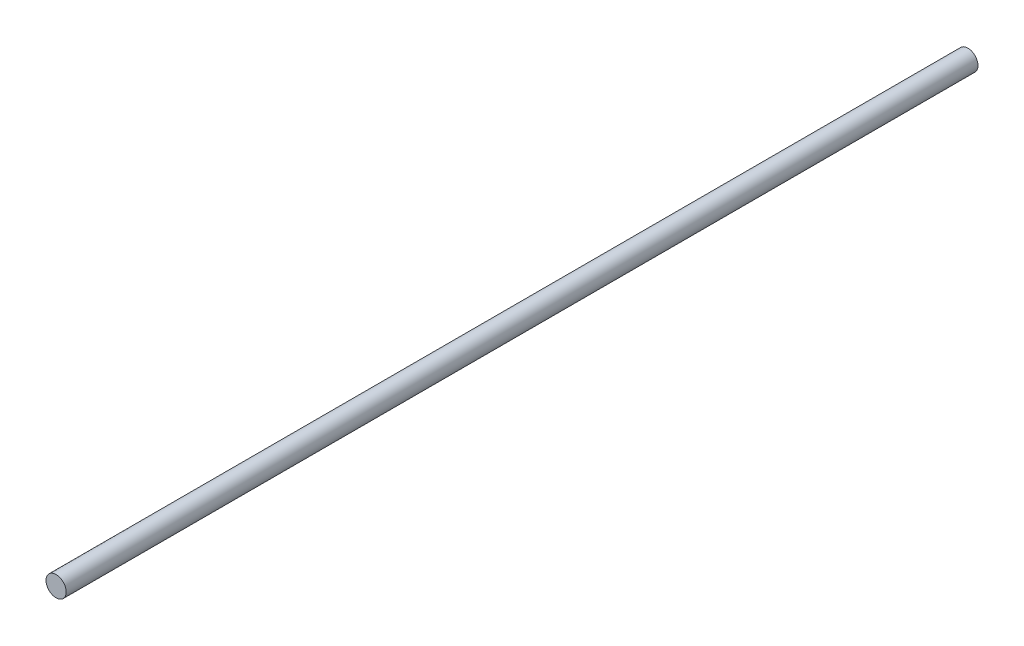
from build123d import *

# Parameters (mm, degrees)
SKIZZE1_R                       = 3.325
AUFSATZ_LINEAR_AUSTRAGEN1_DEPTH = 300


with BuildPart() as part:
    # Skizze1 → Aufsatz-Linear austragen1 (new body)
    with BuildSketch(Plane.XY):
        Circle(SKIZZE1_R)
    extrude(amount=AUFSATZ_LINEAR_AUSTRAGEN1_DEPTH)


solid = part.part
